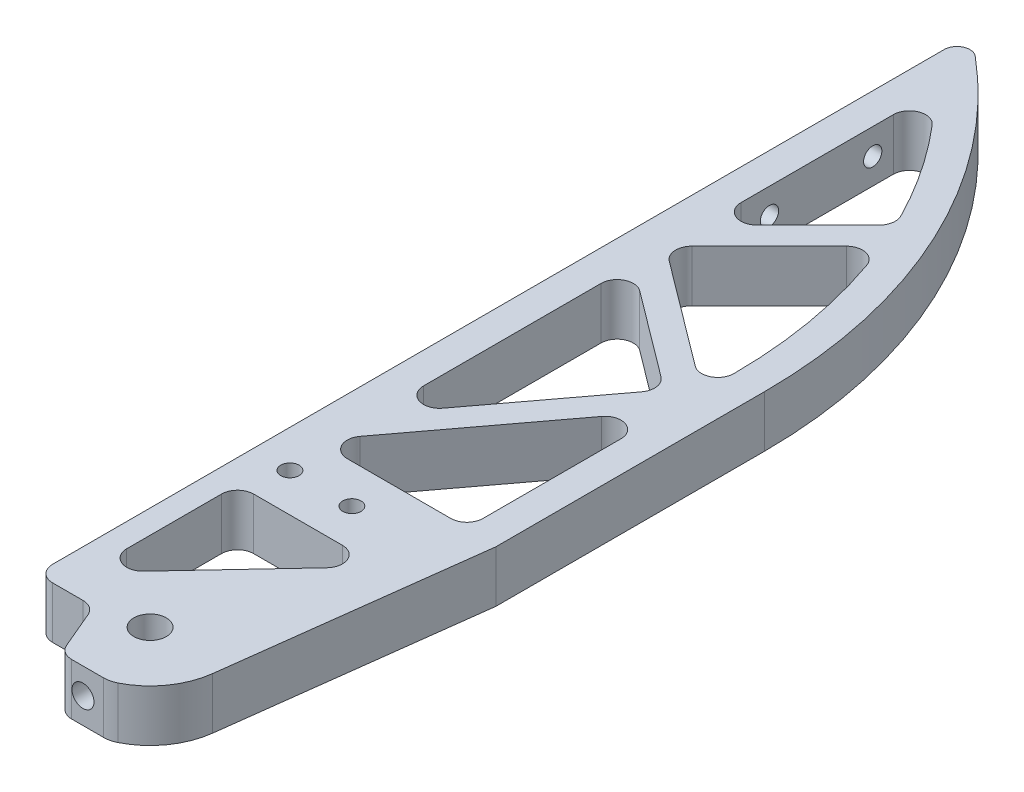
from build123d import *
from OCP.BRepFilletAPI import BRepFilletAPI_MakeFillet

# Parameters (mm, degrees)
SKETCH1_W                      = 50.8
SKETCH1_H                      = 243.84
BOSS_EXTRUDE1_DEPTH            = 6.35
SKETCH2_R                      = 4
PIVOT_POINT_DEPTH              = 126.183610748
MAIN_SHAPE_DEPTH               = 126.183610748
OPTIMIZING_WEIGHT_CUTOUT_DEPTH = 126.183610748
F_8_CLEARANCE_HOLE1_REACH      = 134.233
F_8_CLEARANCE_HOLE1_BORE_R     = 2.2479
F_1_4_28_TAPPED_HOLE1_D        = 5.4102
F_1_4_28_TAPPED_HOLE1_DEPTH    = 13.97
F_1_4_28_TAPPED_HOLE1_TIP      = 1.625388061
FILLET1_R1                     = 3.96875
FILLET1_R2                     = 3.175
F_8_CLEARANCE_HOLE2_D          = 4.4958


with BuildPart() as part:
    # Sketch1 → Boss-Extrude1 (new, symmetric)
    with BuildSketch(Plane(origin=(0, 0, 0), x_dir=(1, 0, 0), z_dir=(0, 1, 0))):
        Rectangle(SKETCH1_W, SKETCH1_H)
    extrude(amount=BOSS_EXTRUDE1_DEPTH, both=True)

    # Sketch2 → Pivot Point (cut, through all)
    with BuildSketch(Plane(origin=(0, 6.35, 0), x_dir=(1, 0, 0), z_dir=(0, 1, 0))):
        with Locations(Location((0, -105.41, 0), (0, 0, 270))):
            Circle(SKETCH2_R)
    extrude(amount=-PIVOT_POINT_DEPTH, mode=Mode.SUBTRACT)

    # Sketch3 → Main Shape (cut, through all)
    with BuildSketch(Plane(origin=(0, 6.35, 0), x_dir=(1, 0, 0), z_dir=(0, 1, 0))):
        Polygon((-11.332366666, -107.95), (-25.4, -107.95), (-25.4, -121.92), (-5.402453483, -121.92), align=None)
        with BuildLine():
            Line((25.4, 121.92), (-25.4, 121.92))
            ThreePointArc((-25.4, 121.92), (11.992253257, 77.116126628), (25.4, 20.32))
            Line((25.4, 20.32), (25.4, 121.92))
        make_face()
        with BuildLine():
            Line((25.4, -121.92), (25.4, -45.72))
            Line((25.4, -45.72), (17.569250135, -107.632186158))
            ThreePointArc((17.569250135, -107.632186158), (14.449275969, -115.648900605), (7.919806331, -121.249612663))
            ThreePointArc((7.919806331, -121.249612663), (6.538931045, -121.750131083), (5.08, -121.92))
            Line((5.08, -121.92), (25.4, -121.92))
        make_face()
    extrude(amount=-MAIN_SHAPE_DEPTH, mode=Mode.SUBTRACT)

    # Sketch4 → Optimizing Weight Cutout (cut, through all)
    with BuildSketch(Plane(origin=(0, 6.35, 0), x_dir=(1, 0, 0), z_dir=(0, 1, 0))):
        with BuildLine():
            ThreePointArc((6.024131859, 71.978790555), (-4.436732062, 89.680534626), (-17.78, 105.324658696))
            Line((-17.78, 105.324658696), (-17.78, 48.174658696))
            Line((-17.78, 48.174658696), (6.024131859, 71.978790555))
        make_face()
        with BuildLine():
            Line((8.791407169, 65.765809744), (-17.78, 39.194402575))
            Line((-17.78, 39.194402575), (17.78, 12.524402575))
            Line((17.78, 12.524402575), (17.78, 20.32))
            ThreePointArc((17.78, 20.32), (15.511294476, 43.483097938), (8.791407169, 65.765809744))
        make_face()
        Polygon((12.7, 8.396902575), (-17.78, 31.256902575), (-17.78, -32.243097425), align=None)
        Polygon((17.78, -45.240017282), (17.78, 4.586902575), (-19.590189893, -45.240017282), align=None)
        Polygon((15.370526289, -64.290017282), (-19.590189893, -64.290017282), (-19.590189893, -101.6), align=None)
    extrude(amount=-OPTIMIZING_WEIGHT_CUTOUT_DEPTH, mode=Mode.SUBTRACT)

    # #8 Clearance Hole1 bore → #8 Clearance Hole1 (cut, up to next)
    with BuildSketch(Plane.ZY.offset(25.4), mode=Mode.PRIVATE) as f_8_clearance_hole1_sk1:
        with Locations((-90.17, 0)):
            Circle(F_8_CLEARANCE_HOLE1_BORE_R)
    f_8_clearance_hole1_tool1 = extrude(f_8_clearance_hole1_sk1.sketch, amount=-F_8_CLEARANCE_HOLE1_REACH, mode=Mode.PRIVATE) & part.part
    # #8 Clearance Hole1 bore → #8 Clearance Hole1 (cut, up to next)
    with BuildSketch(Plane.ZY.offset(25.4), mode=Mode.PRIVATE) as f_8_clearance_hole1_sk2:
        with Locations((-64.77, 0)):
            Circle(F_8_CLEARANCE_HOLE1_BORE_R)
    f_8_clearance_hole1_tool2 = extrude(f_8_clearance_hole1_sk2.sketch, amount=-F_8_CLEARANCE_HOLE1_REACH, mode=Mode.PRIVATE) & part.part
    add(f_8_clearance_hole1_tool1.solids().sort_by_distance((-25.4, 0, -90.17))[0], mode=Mode.SUBTRACT)
    add(f_8_clearance_hole1_tool2.solids().sort_by_distance((-25.4, 0, -64.77))[0], mode=Mode.SUBTRACT)

    # 1/4-28 Tapped Hole1
    with Locations(Plane.XY.offset(121.92)):
        with Locations((0, 0)):
            Hole(F_1_4_28_TAPPED_HOLE1_D / 2, depth=F_1_4_28_TAPPED_HOLE1_DEPTH)
            with Locations((0, 0, -(F_1_4_28_TAPPED_HOLE1_DEPTH + F_1_4_28_TAPPED_HOLE1_TIP / 2))):  # 118° drill point
                Cone(0, F_1_4_28_TAPPED_HOLE1_D / 2, F_1_4_28_TAPPED_HOLE1_TIP, mode=Mode.SUBTRACT)

    # Fillet1: one fillet with a radius per group of edges: ONE call of the kernel's fillet builder (fillet() takes one radius for all edges)
    fillet1_edges_1 = [part.edges().sort_by_distance(p)[0] for p in [
        (-17.78, 0, -39.194402575),
        (17.78, 0, -12.524402575),
        (-17.78, 0, -31.256902575),
        (8.791407169, 0, -65.765809744),
        (6.024131859, 0, -71.978790555),
        (-17.78, 0, -48.174658696),
        (-17.78, 0, -105.324658696),
        (-5.402453483, 0, 121.92),
        (-25.4, 0, 107.95),
        (-11.332366666, 0, 107.95),
        (-17.78, 0, 32.243097425),
        (12.7, 0, -8.396902575),
        (-19.590189893, 0, 45.240017282),
        (17.78, 0, -4.586902575),
        (17.78, 0, 45.240017282),
        (-19.590189893, 0, 101.6),
        (-19.590189893, 0, 64.290017282),
        (15.370526289, 0, 64.290017282),
    ]]
    fillet1_edges_2 = [part.edges().sort_by_distance(p)[0] for p in [
        (-25.4, 0, -121.92),
    ]]
    fillet1 = BRepFilletAPI_MakeFillet(part.part.solid().wrapped)
    for e in fillet1_edges_1:
        fillet1.Add(FILLET1_R1, e.wrapped)
    for e in fillet1_edges_2:
        fillet1.Add(FILLET1_R2, e.wrapped)
    add(Compound.cast(fillet1.Shape()), mode=Mode.REPLACE)

    # #8 Clearance Hole2 (through all)
    with Locations(Plane(origin=(0, 6.35, 0), x_dir=(1, 0, 0), z_dir=(0, 1, 0))):
        with Locations((-16.2052, -54.79148033), (-0.9652, -54.79148033)):
            Hole(F_8_CLEARANCE_HOLE2_D / 2)


solid = part.part
